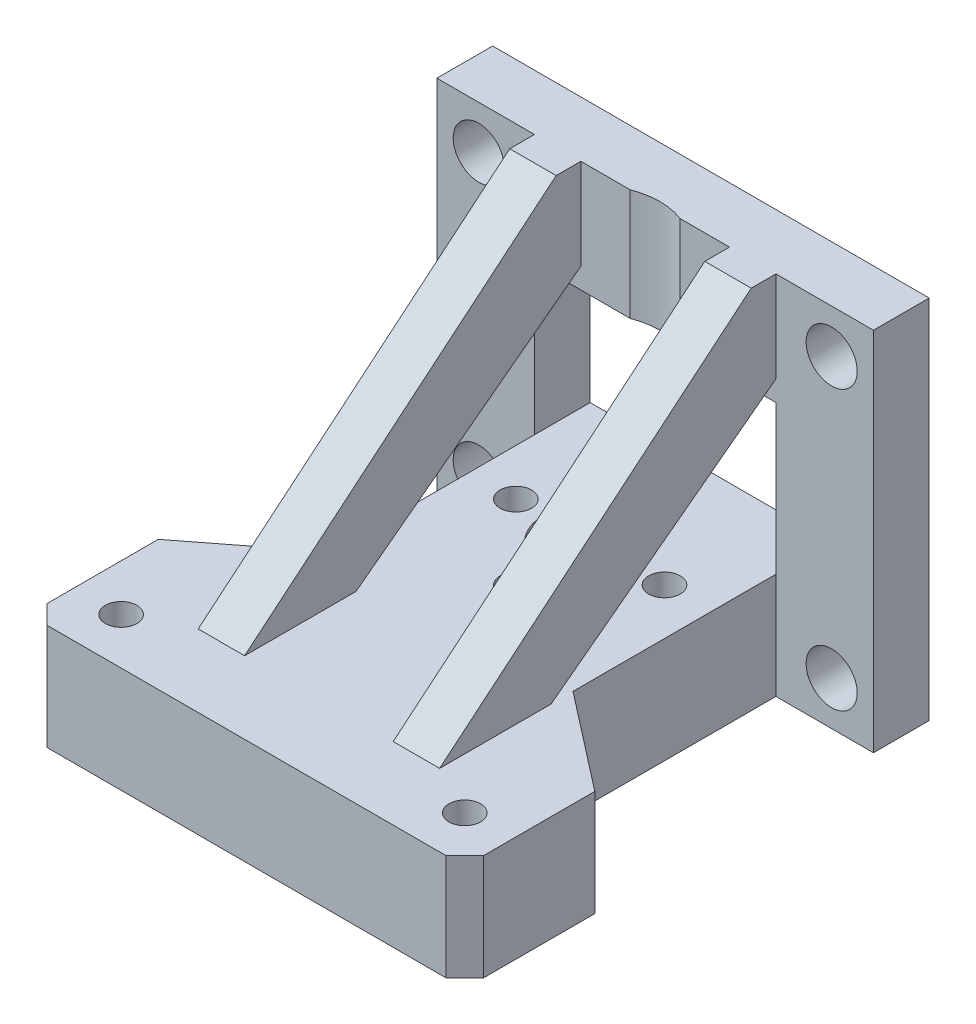
from build123d import *

# Parameters (mm, degrees)
SKETCH1_W                = 47
SKETCH1_H                = 39.4
BOSS_EXTRUDE1_DEPTH      = 50
SKETCH3_W                = 10.5
SKETCH3_H                = 30
CUT_EXTRUDE1_DEPTH       = 50
SKETCH19_R               = 5
CUT_EXTRUDE6_DEPTH       = 68.857276692
M5_CLEARANCE_HOLE1_D     = 5.5
M5_CLEARANCE_HOLE1_DEPTH = 6
SKETCH25_R               = 7.5
CUT_EXTRUDE7_DEPTH       = 28
CUT_EXTRUDE8_DEPTH       = 28
SKETCH27_W               = 26
SKETCH27_H               = 16
CUT_EXTRUDE9_DEPTH       = 28
CUT_EXTRUDE10_REACH      = 69.857
SKETCH28_R               = 1.7
BOSS_EXTRUDE2_DEPTH      = 26
SKETCH30_W               = 16
SKETCH30_H               = 41.736735488
CUT_EXTRUDE11_DEPTH      = 28
BOSS_EXTRUDE3_START      = -11.4
BOSS_EXTRUDE3_DEPTH      = 11.4
CHAMFER1_SIZE            = 2


with BuildPart() as part:
    # Sketch1 → Boss-Extrude1 (new body)
    with BuildSketch(Plane.XY):
        Rectangle(SKETCH1_W, SKETCH1_H)
    extrude(amount=BOSS_EXTRUDE1_DEPTH)

    # Sketch3 → Cut-Extrude1 (cut)
    with BuildSketch(Plane(origin=(0, 19.7, 0), x_dir=(1, 0, 0), z_dir=(0, 1, 0))):
        with Locations((18.25, -21)):
            Rectangle(SKETCH3_W, SKETCH3_H)
        with Locations((-18.25, -21)):
            Rectangle(SKETCH3_W, SKETCH3_H)
    extrude(amount=-CUT_EXTRUDE1_DEPTH, mode=Mode.SUBTRACT)

    # Sketch19 → Cut-Extrude6 (cut, through all)
    with BuildSketch(Plane.XZ.offset(19.7)):
        with Locations(Location((0, 13, 0), (0, 0, 270))):
            Circle(SKETCH19_R)
    extrude(amount=-CUT_EXTRUDE6_DEPTH, mode=Mode.SUBTRACT)

    # M5 Clearance Hole1
    with Locations(Plane(origin=(0, 0, 0), x_dir=(-1, 0, 0), z_dir=(0, 0, -1))):
        with Locations((-19, -15), (-19, 15), (19, 15), (19, -15)):
            Hole(M5_CLEARANCE_HOLE1_D / 2, depth=M5_CLEARANCE_HOLE1_DEPTH)

    # Sketch25 → Cut-Extrude7 (cut)
    with BuildSketch(Plane(origin=(0, 19.7, 0), x_dir=(1, 0, 0), z_dir=(0, 1, 0))):
        with Locations(Location((0, -13, 0), (0, 0, 270))):
            Circle(SKETCH25_R)
    extrude(amount=-CUT_EXTRUDE7_DEPTH, mode=Mode.SUBTRACT)

    # Sketch26 → Cut-Extrude8 (cut)
    with BuildSketch(Plane(origin=(0, 19.7, 0), x_dir=(1, 0, 0), z_dir=(0, 1, 0))):
        Polygon((13, -6), (13, -36), (23.5, -36), (23.5, -50), (-23.5, -50), (-23.5, -36), (-13, -36), (-13, -6), align=None)
    extrude(amount=-CUT_EXTRUDE8_DEPTH, mode=Mode.SUBTRACT)

    # Sketch27 → Cut-Extrude9 (cut)
    with BuildSketch(Plane.XY.offset(6)):
        with Locations((0, -0.3)):
            Rectangle(SKETCH27_W, SKETCH27_H)
    extrude(amount=-CUT_EXTRUDE9_DEPTH, mode=Mode.SUBTRACT)

    # Sketch28 → Cut-Extrude10 (cut, up to next)
    with BuildSketch(Plane.XZ.offset(19.7), mode=Mode.PRIVATE) as cut_extrude10_sk1:
        with Locations(Location((0, 21, 0), (0, 0, 270))):
            Circle(SKETCH28_R)
    cut_extrude10_tool1 = extrude(cut_extrude10_sk1.sketch, amount=-CUT_EXTRUDE10_REACH, mode=Mode.PRIVATE) & part.part
    # Sketch28 → Cut-Extrude10 (cut, up to next)
    with BuildSketch(Plane.XZ.offset(19.7), mode=Mode.PRIVATE) as cut_extrude10_sk2:
        with Locations(Location((8, 13, 0), (0, 0, 270))):
            Circle(SKETCH28_R)
    cut_extrude10_tool2 = extrude(cut_extrude10_sk2.sketch, amount=-CUT_EXTRUDE10_REACH, mode=Mode.PRIVATE) & part.part
    # Sketch28 → Cut-Extrude10 (cut, up to next)
    with BuildSketch(Plane.XZ.offset(19.7), mode=Mode.PRIVATE) as cut_extrude10_sk3:
        with Locations(Location((0, 5, 0), (0, 0, 270))):
            Circle(SKETCH28_R)
    cut_extrude10_tool3 = extrude(cut_extrude10_sk3.sketch, amount=-CUT_EXTRUDE10_REACH, mode=Mode.PRIVATE) & part.part
    # Sketch28 → Cut-Extrude10 (cut, up to next)
    with BuildSketch(Plane.XZ.offset(19.7), mode=Mode.PRIVATE) as cut_extrude10_sk4:
        with Locations(Location((-8, 13, 0), (0, 0, 270))):
            Circle(SKETCH28_R)
    cut_extrude10_tool4 = extrude(cut_extrude10_sk4.sketch, amount=-CUT_EXTRUDE10_REACH, mode=Mode.PRIVATE) & part.part
    # Sketch28 → Cut-Extrude10 (cut, up to next)
    with BuildSketch(Plane.XZ.offset(19.7), mode=Mode.PRIVATE) as cut_extrude10_sk5:
        with Locations(Location((-18.5, 45, 0), (0, 0, 270))):
            Circle(SKETCH28_R)
    cut_extrude10_tool5 = extrude(cut_extrude10_sk5.sketch, amount=-CUT_EXTRUDE10_REACH, mode=Mode.PRIVATE) & part.part
    # Sketch28 → Cut-Extrude10 (cut, up to next)
    with BuildSketch(Plane.XZ.offset(19.7), mode=Mode.PRIVATE) as cut_extrude10_sk6:
        with Locations(Location((18.5, 45, 0), (0, 0, 270))):
            Circle(SKETCH28_R)
    cut_extrude10_tool6 = extrude(cut_extrude10_sk6.sketch, amount=-CUT_EXTRUDE10_REACH, mode=Mode.PRIVATE) & part.part
    add(cut_extrude10_tool1.solids().sort_by_distance((0, -19.7, 21))[0], mode=Mode.SUBTRACT)
    add(cut_extrude10_tool2.solids().sort_by_distance((8, -19.7, 13))[0], mode=Mode.SUBTRACT)
    add(cut_extrude10_tool3.solids().sort_by_distance((0, -19.7, 5))[0], mode=Mode.SUBTRACT)
    add(cut_extrude10_tool4.solids().sort_by_distance((-8, -19.7, 13))[0], mode=Mode.SUBTRACT)
    add(cut_extrude10_tool5.solids().sort_by_distance((-18.5, -19.7, 45))[0], mode=Mode.SUBTRACT)
    add(cut_extrude10_tool6.solids().sort_by_distance((18.5, -19.7, 45))[0], mode=Mode.SUBTRACT)

    # Sketch29 → Boss-Extrude2 (add)
    with BuildSketch(Plane(origin=(13, 0, 0), x_dir=(0, 0, -1), z_dir=(1, 0, 0))):
        Polygon((-42.205748108, -8.3), (-30.205748108, -8.3), (-6, 9.919793382), (-6, 19.7), (-8.659491381, 19.7), align=None)
    extrude(amount=-BOSS_EXTRUDE2_DEPTH)

    # Sketch30 → Cut-Extrude11 (cut)
    with BuildSketch(Plane(origin=(0, 19.7, 0), x_dir=(1, 0, 0), z_dir=(0, 1, 0))):
        with Locations((0, -26.868367744)):
            Rectangle(SKETCH30_W, SKETCH30_H)
    extrude(amount=-CUT_EXTRUDE11_DEPTH, mode=Mode.SUBTRACT)

    # Sketch31 → Boss-Extrude3 (add)
    with BuildSketch(Plane.XZ.offset(19.7).offset(BOSS_EXTRUDE3_START)):
        Polygon((-23.5, 36), (-13, 36), (-13, 27.846939537), align=None)
        Polygon((13, 36), (13, 27.846939537), (23.5, 36), align=None)
    extrude(amount=BOSS_EXTRUDE3_DEPTH)

    # Chamfer1
    chamfer1_edges = [part.edges().sort_by_distance(p)[0] for p in [
        (23.5, -14, 50),
        (-23.5, -14, 50),
    ]]
    chamfer(chamfer1_edges, length=CHAMFER1_SIZE)


solid = part.part
